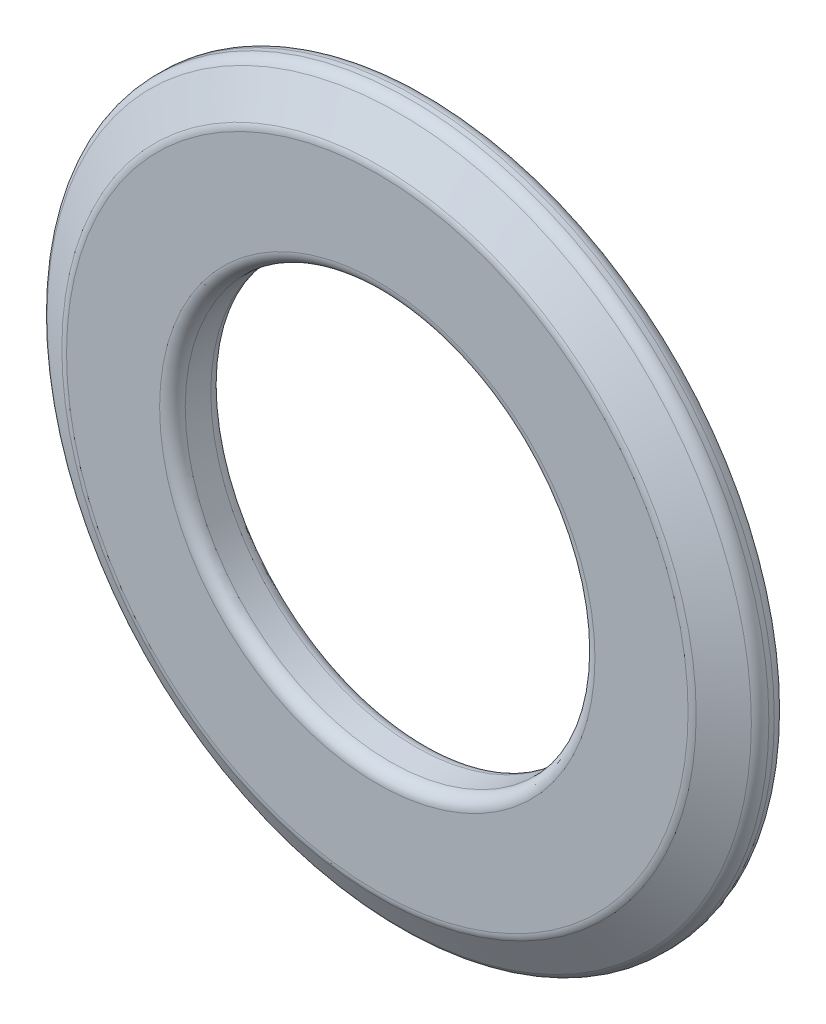
from build123d import *

# Parameters (mm, degrees)
SKETCH1_R           = 7
SKETCH1_R_2         = 4
BOSS_EXTRUDE1_DEPTH = 1
CHAMFER1_SIZE       = 0.5
CHAMFER1_SIZE2      = 0.866025404
FILLET1_R           = 0.25


with BuildPart() as part:
    # Sketch1 → Boss-Extrude1 (new body)
    with BuildSketch(Plane.XY):
        with Locations((15.2300359, -44.782538686)):
            Circle(SKETCH1_R)
        with Locations((15.2300359, -44.782538686)):
            Circle(SKETCH1_R_2, mode=Mode.SUBTRACT)
    extrude(amount=BOSS_EXTRUDE1_DEPTH)

    # Chamfer1
    chamfer1_edges = [part.edges().sort_by_distance(p)[0] for p in [
        (8.2300359, -44.782538686, 1),
    ]]
    chamfer1_side = [part.faces().sort_by_distance(p)[0] for p in [
        (8.2300359, -44.782538686, 0.5),
    ]]
    chamfer(chamfer1_edges, length=CHAMFER1_SIZE, length2=CHAMFER1_SIZE2, reference=chamfer1_side[0])

    # Fillet1
    fillet1_edges = [part.edges().sort_by_distance(p)[0] for p in [
        (8.2300359, -44.782538686, 0),
        (11.2300359, -44.782538686, 0),
        (11.2300359, -44.782538686, 1),
        (9.096061304, -44.782538686, 1),
        (8.2300359, -44.782538686, 0.5),
    ]]
    fillet(fillet1_edges, radius=FILLET1_R)


solid = part.part
